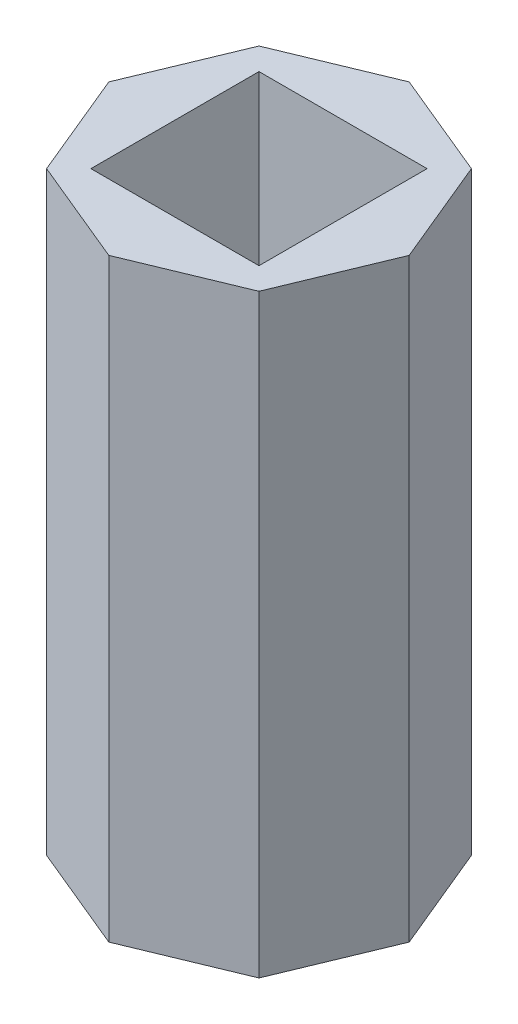
from build123d import *

# Parameters (mm, degrees)
SKETCH1_W           = 6.731
SKETCH1_H           = 6.731
BOSS_EXTRUDE1_DEPTH = 11.90625


with BuildPart() as part:
    # Sketch1 → Boss-Extrude1 (new, symmetric)
    with BuildSketch(Plane(origin=(0, 0, 0), x_dir=(1, 0, 0), z_dir=(0, 1, 0))):
        Polygon((6.014041663, 0), (4.252569642, 4.252569642), (0, 6.014041663), (-4.252569642, 4.252569642), (-6.014041663, 0), (-4.252569642, -4.252569642), (0, -6.014041663), (4.252569642, -4.252569642), align=None)
        Rectangle(SKETCH1_W, SKETCH1_H, mode=Mode.SUBTRACT)
    extrude(amount=BOSS_EXTRUDE1_DEPTH, both=True)


solid = part.part
